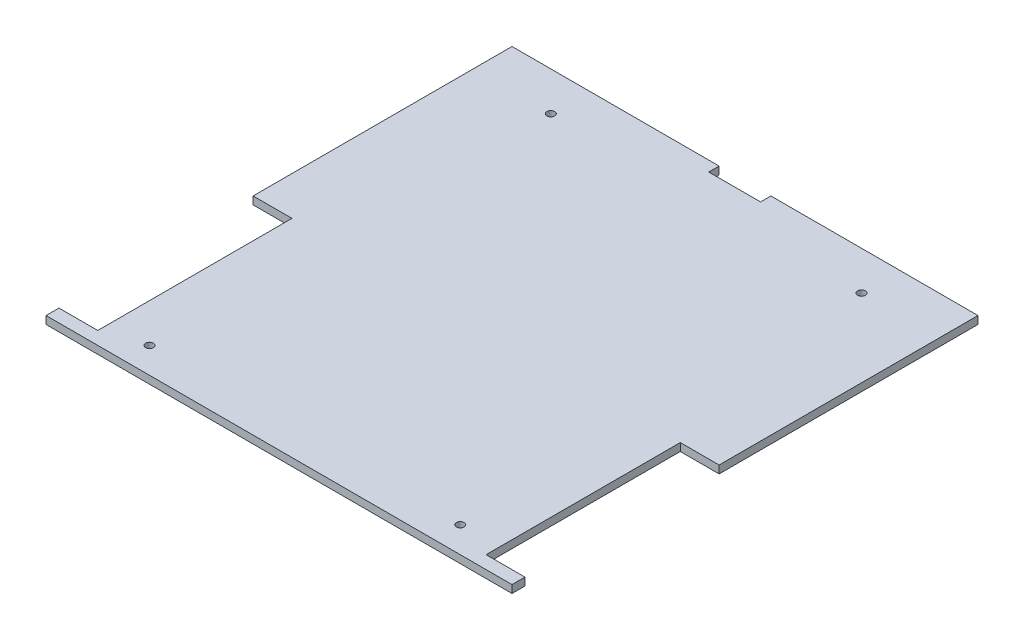
from build123d import *

# Parameters (mm, degrees)
SKETCH1_W           = 180
SKETCH1_H           = 180
BOSS_EXTRUDE1_DEPTH = 3
SKETCH2_W           = 15
SKETCH2_H           = 75
CUT_EXTRUDE1_DEPTH  = 3
SKETCH3_R           = 1.5
CUT_EXTRUDE2_DEPTH  = 3
SKETCH4_W           = 20
SKETCH4_H           = 4
CUT_EXTRUDE3_DEPTH  = 10


with BuildPart() as part:
    # Sketch1 → Boss-Extrude1 (new body)
    with BuildSketch(Plane(origin=(0, 0, 0), x_dir=(1, 0, 0), z_dir=(0, 1, 0))):
        Rectangle(SKETCH1_W, SKETCH1_H)
    extrude(amount=BOSS_EXTRUDE1_DEPTH)

    # Sketch2 → Cut-Extrude1 (cut)
    with BuildSketch(Plane(origin=(0, 3, 0), x_dir=(1, 0, 0), z_dir=(0, 1, 0))):
        with Locations((-82.5, -47.5)):
            Rectangle(SKETCH2_W, SKETCH2_H)
        with Locations((82.5, -47.5)):
            Rectangle(SKETCH2_W, SKETCH2_H)
    extrude(amount=-CUT_EXTRUDE1_DEPTH, mode=Mode.SUBTRACT)

    # Sketch3 → Cut-Extrude2 (cut)
    with BuildSketch(Plane(origin=(0, 3, 0), x_dir=(1, 0, 0), z_dir=(0, 1, 0))):
        with Locations(Location((-60, -80, 0), (0, 0, 270))):
            Circle(SKETCH3_R)
        with Locations(Location((60, -80, 0), (0, 0, 90))):
            Circle(SKETCH3_R)
        with Locations(Location((-60, 75, 0), (0, 0, 270))):
            Circle(SKETCH3_R)
        with Locations(Location((60, 75, 0), (0, 0, 90))):
            Circle(SKETCH3_R)
    extrude(amount=-CUT_EXTRUDE2_DEPTH, mode=Mode.SUBTRACT)

    # Sketch4 → Cut-Extrude3 (cut)
    with BuildSketch(Plane(origin=(0, 3, 0), x_dir=(1, 0, 0), z_dir=(0, 1, 0))):
        with Locations((0, 88)):
            Rectangle(SKETCH4_W, SKETCH4_H)
    extrude(amount=-CUT_EXTRUDE3_DEPTH, mode=Mode.SUBTRACT)


solid = part.part
